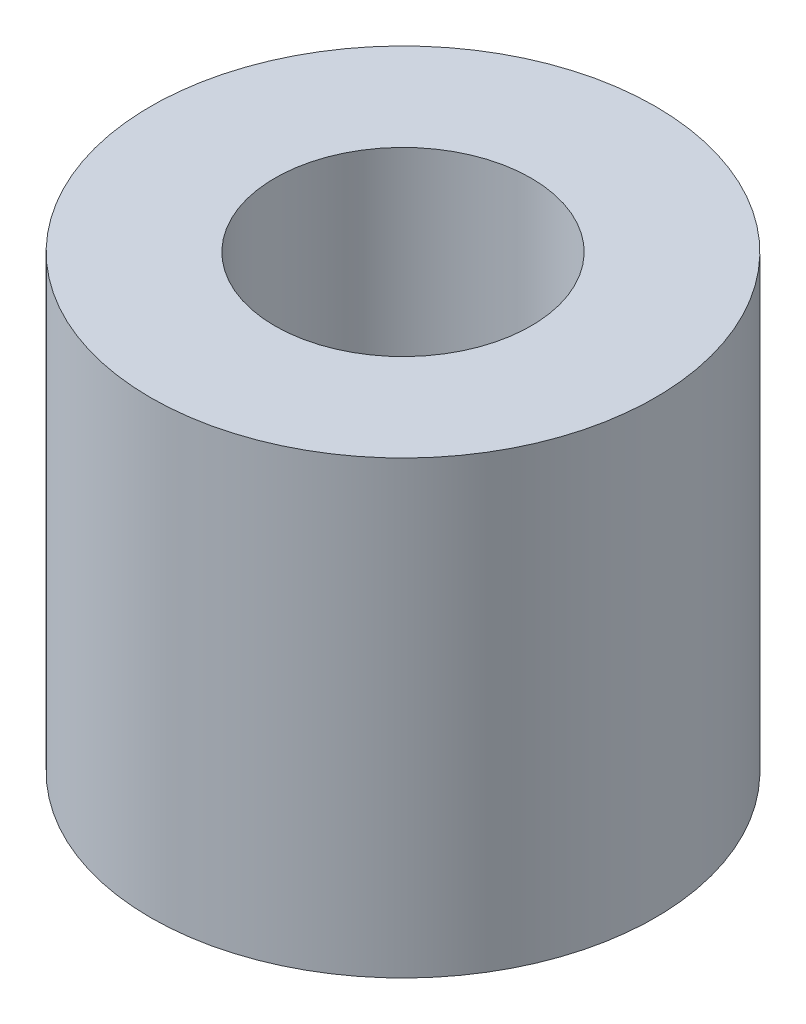
from build123d import *

# Parameters (mm, degrees)
SKETCH_1_R      = 3.25
SKETCH_1_R_2    = 1.65
EXTRUDE_1_DEPTH = 5.8


with BuildPart() as part:
    # 草图1 → 凸台-拉伸1 (new body)
    with BuildSketch(Plane(origin=(0, 0, 0), x_dir=(1, 0, 0), z_dir=(0, 1, 0))):
        with Locations(Location((0, 0, 0), (0, 0, 270))):
            Circle(SKETCH_1_R)
        with Locations(Location((0, 0, 0), (0, 0, 270))):
            Circle(SKETCH_1_R_2, mode=Mode.SUBTRACT)
    extrude(amount=EXTRUDE_1_DEPTH)


solid = part.part
